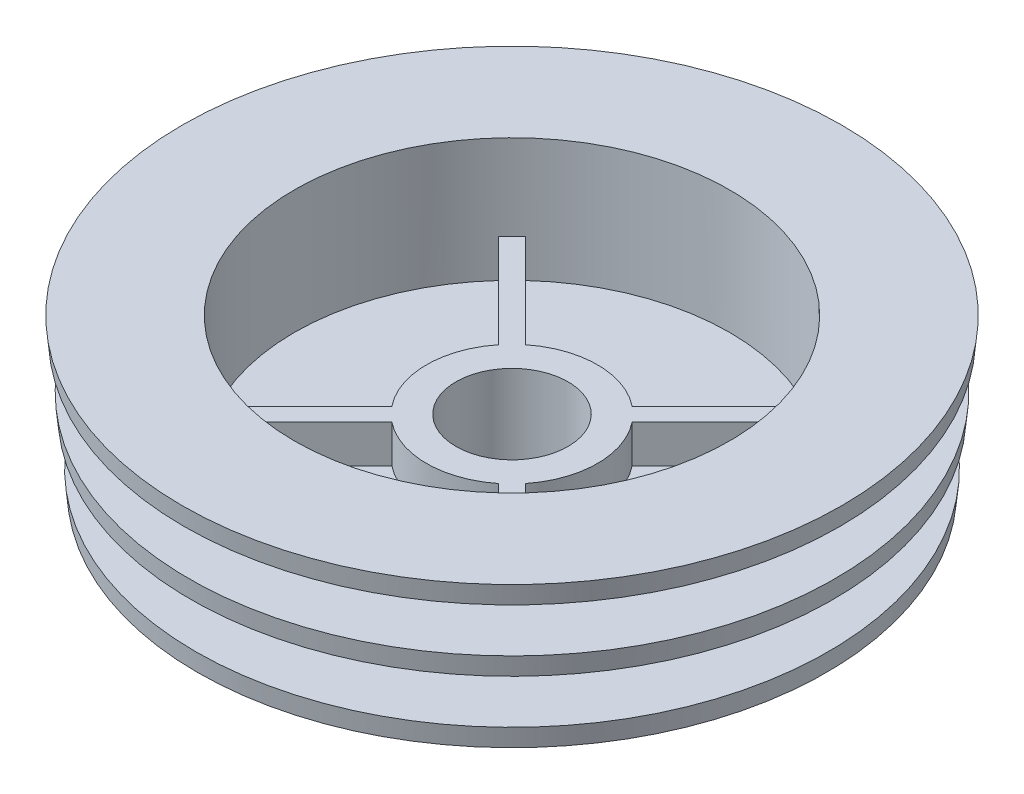
from build123d import *
from build123d.topology import SkipClean

# Parameters (mm, degrees)
ESQUISSE2_R              = 2.95
ENL_V_MAT_EXTRU_1_DEPTH  = 3
ESQUISSE3_R              = 11.45
ENL_V_MAT_EXTRU_2_DEPTH  = 4.5
ENL_V_MAT_EXTRU_11_DEPTH = 2
ENL_V_START              = -5.5
ESQUISSE4_R              = 2.95
ENL_V_MAT_EXTRU_3_DEPTH  = 5.5
ESQUISSE6_R              = 1.4
ENL_V_MAT_EXTRU_9_DEPTH  = 27.496131793
ENL_V_START_2            = 5
ESQUISSE7_W              = 1
ESQUISSE7_H              = 1
ENL_V_MAT_EXTRU_10_DEPTH = 24.249690264


with BuildPart() as part:
    # Esquisse1 → Révolution1 (revolve)
    with BuildSketch(Plane.XY, mode=Mode.PRIVATE) as r_volution1_sk:
        Polygon((0, 0), (4.6, 0), (4.6, 6), (16.55, 6), (16.65, 7), (12.25, 7), (12.25, 9.5), (16.9, 9.5), (17, 10.5), (12.25, 10.5), (12.25, 13), (17.25, 13), (17.35, 14), (0, 14), align=None)
    revolve(r_volution1_sk.sketch.rotate(Axis((0, 0, 0), (0, 1, 0)), 90), axis=Axis((0, 0, 0), (0, 1, 0)))

    # Esquisse2 → Enlèv. mat.-Extru.1 (cut)
    with BuildSketch(Plane.XZ):
        with Locations(Location((0, 0, 0), (0, 0, 270))):
            Circle(ESQUISSE2_R)
    extrude(amount=-ENL_V_MAT_EXTRU_1_DEPTH, mode=Mode.SUBTRACT)

    # Esquisse3 → Enlèv. mat.-Extru.2 (cut)
    with BuildSketch(Plane(origin=(0, 14, 0), x_dir=(1, 0, 0), z_dir=(0, 1, 0))):
        with Locations(Location((0, 0, 0), (0, 0, 270))):
            Circle(ESQUISSE3_R)
    extrude(amount=-ENL_V_MAT_EXTRU_2_DEPTH, mode=Mode.SUBTRACT)

    # Esquisse8 → Enlèv. mat.-Extru.11 (cut)
    with SkipClean():  # the faces are left unmerged after this step: merging them gives an invalid solid
        with BuildSketch(Plane(origin=(0, 9.5, 0), x_dir=(1, 0, 0), z_dir=(0, 1, 0))):
            with BuildLine():
                Line((2.80872427, 3.515831051), (7.735096064, 8.442202845))
                ThreePointArc((7.735096064, 8.442202845), (0, 11.45), (-7.735096064, 8.442202845))
                Line((-7.735096064, 8.442202845), (-2.80872427, 3.515831051))
                ThreePointArc((-2.80872427, 3.515831051), (0, 4.5), (2.80872427, 3.515831051))
            make_face()
            with BuildLine():
                Line((3.515831051, 2.80872427), (8.442202845, 7.735096064))
                ThreePointArc((8.442202845, 7.735096064), (11.45, 0), (8.442202845, -7.735096064))
                Line((8.442202845, -7.735096064), (3.515831051, -2.80872427))
                ThreePointArc((3.515831051, -2.80872427), (4.5, 0), (3.515831051, 2.80872427))
            make_face()
            with BuildLine():
                Line((2.80872427, -3.515831051), (7.735096064, -8.442202845))
                ThreePointArc((7.735096064, -8.442202845), (0, -11.45), (-7.735096064, -8.442202845))
                Line((-7.735096064, -8.442202845), (-2.80872427, -3.515831051))
                ThreePointArc((-2.80872427, -3.515831051), (0, -4.5), (2.80872427, -3.515831051))
            make_face()
            with BuildLine():
                Line((-3.515831051, -2.80872427), (-8.442202845, -7.735096064))
                ThreePointArc((-8.442202845, -7.735096064), (-11.45, 0), (-8.442202845, 7.735096064))
                Line((-8.442202845, 7.735096064), (-3.515831051, 2.80872427))
                ThreePointArc((-3.515831051, 2.80872427), (-4.5, 0), (-3.515831051, -2.80872427))
            make_face()
        extrude(amount=-ENL_V_MAT_EXTRU_11_DEPTH, mode=Mode.SUBTRACT)

    # Esquisse4 → Enlèv. mat.-Extru.3 (cut)
    with SkipClean():  # the faces are left unmerged after this step: merging them gives an invalid solid
        with BuildSketch(Plane(origin=(0, 9.5, 0), x_dir=(1, 0, 0), z_dir=(0, 1, 0)).offset(ENL_V_START)):
            with Locations(Location((0, 0, 0), (0, 0, 90))):
                Circle(ESQUISSE4_R)
        extrude(amount=ENL_V_MAT_EXTRU_3_DEPTH, mode=Mode.SUBTRACT)

    # Esquisse6 → Enlèv. mat.-Extru.9 (cut, through all)
    with SkipClean():  # the faces are left unmerged after this step: merging them gives an invalid solid
        with BuildSketch(Plane(origin=(0, 4, 0), x_dir=(1, 0, 0), z_dir=(0, 1, 0))):
            with Locations(Location((0, 0, 0), (0, 0, 270))):
                Circle(ESQUISSE6_R)
        extrude(amount=-ENL_V_MAT_EXTRU_9_DEPTH, mode=Mode.SUBTRACT)

    # Esquisse7 → Enlèv. mat.-Extru.10 (cut, through all)
    with BuildSketch(Plane(origin=(0, 0, 0), x_dir=(0, 0, -1), z_dir=(1, 0, 0)).offset(ENL_V_START_2)):
        with Locations((0, 11.75)):
            Rectangle(ESQUISSE7_W, ESQUISSE7_H)
        with Locations((0, 8.25)):
            Rectangle(ESQUISSE7_W, ESQUISSE7_H)
    extrude(amount=ENL_V_MAT_EXTRU_10_DEPTH, mode=Mode.SUBTRACT)


solid = part.part
